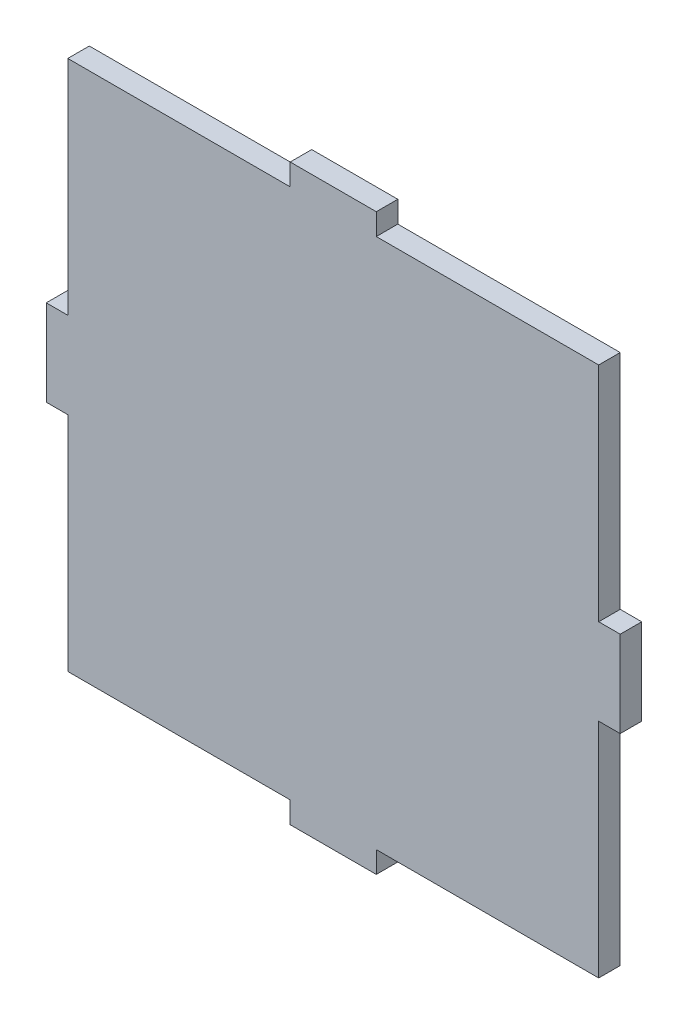
from build123d import *

# Parameters (mm, degrees)
BOSS_EXTRU_1_DEPTH = 3


with BuildPart() as part:
    # Esquisse1 → Boss.-Extru.1 (new body)
    with BuildSketch(Plane.XY):
        Polygon((6, 37), (37, 37), (37, 6), (40, 6), (40, -6), (37, -6), (37, -37), (6, -37), (6, -40), (-6, -40), (-6, -37), (-37, -37), (-37, -6), (-40, -6), (-40, 6), (-37, 6), (-37, 37), (-6, 37), (-6, 40), (6, 40), align=None)
    extrude(amount=BOSS_EXTRU_1_DEPTH)


solid = part.part
